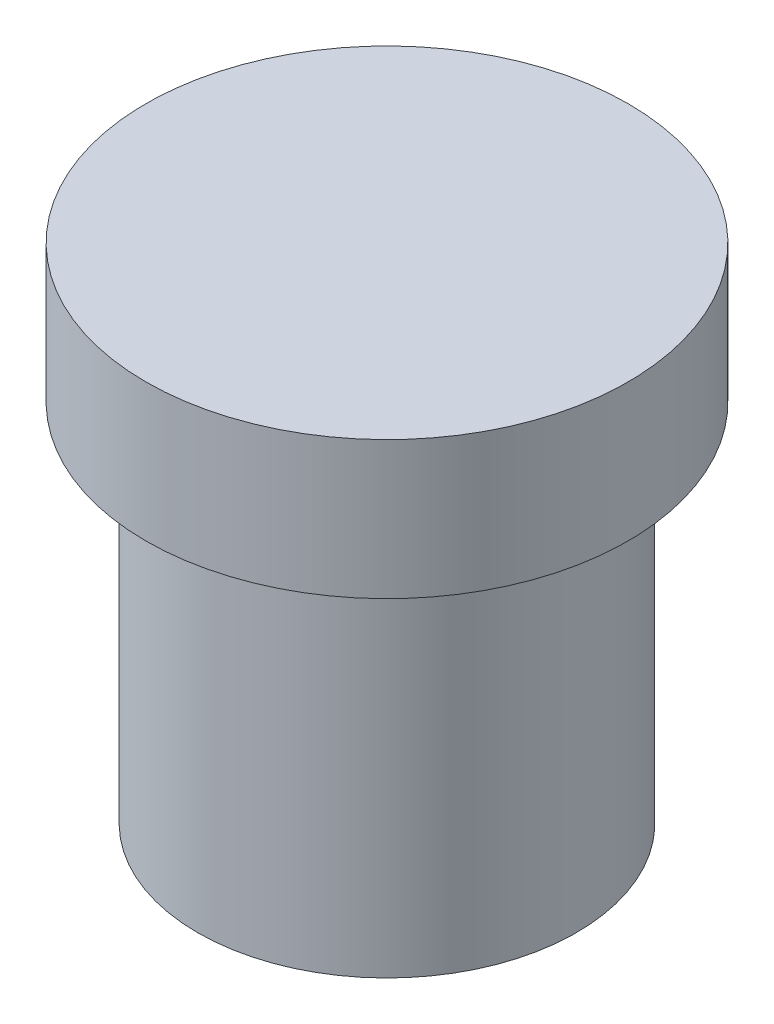
from build123d import *

# Parameters (mm, degrees)
SKETCH1_R           = 1.25
BOSS_EXTRUDE1_DEPTH = 2.5
SKETCH2_R           = 6.875
BOSS_EXTRUDE2_DEPTH = 13.25
SKETCH3_R           = 8.75
BOSS_EXTRUDE3_DEPTH = 5


with BuildPart() as part:
    # Sketch1 → Boss-Extrude1 (new body)
    with BuildSketch(Plane(origin=(0, 0, 0), x_dir=(1, 0, 0), z_dir=(0, 1, 0))):
        with Locations(Location((0, 0, 0), (0, 0, 270))):
            Circle(SKETCH1_R)
    extrude(amount=BOSS_EXTRUDE1_DEPTH)

    # Sketch2 → Boss-Extrude2 (add)
    with BuildSketch(Plane(origin=(0, 2.5, 0), x_dir=(1, 0, 0), z_dir=(0, 1, 0))):
        with Locations(Location((0, 0, 0), (0, 0, 270))):
            Circle(SKETCH2_R)
    extrude(amount=BOSS_EXTRUDE2_DEPTH)

    # Sketch3 → Boss-Extrude3 (add)
    with BuildSketch(Plane(origin=(0, 15.75, 0), x_dir=(1, 0, 0), z_dir=(0, 1, 0))):
        with Locations(Location((0, 0, 0), (0, 0, 270))):
            Circle(SKETCH3_R)
    extrude(amount=BOSS_EXTRUDE3_DEPTH)


solid = part.part
